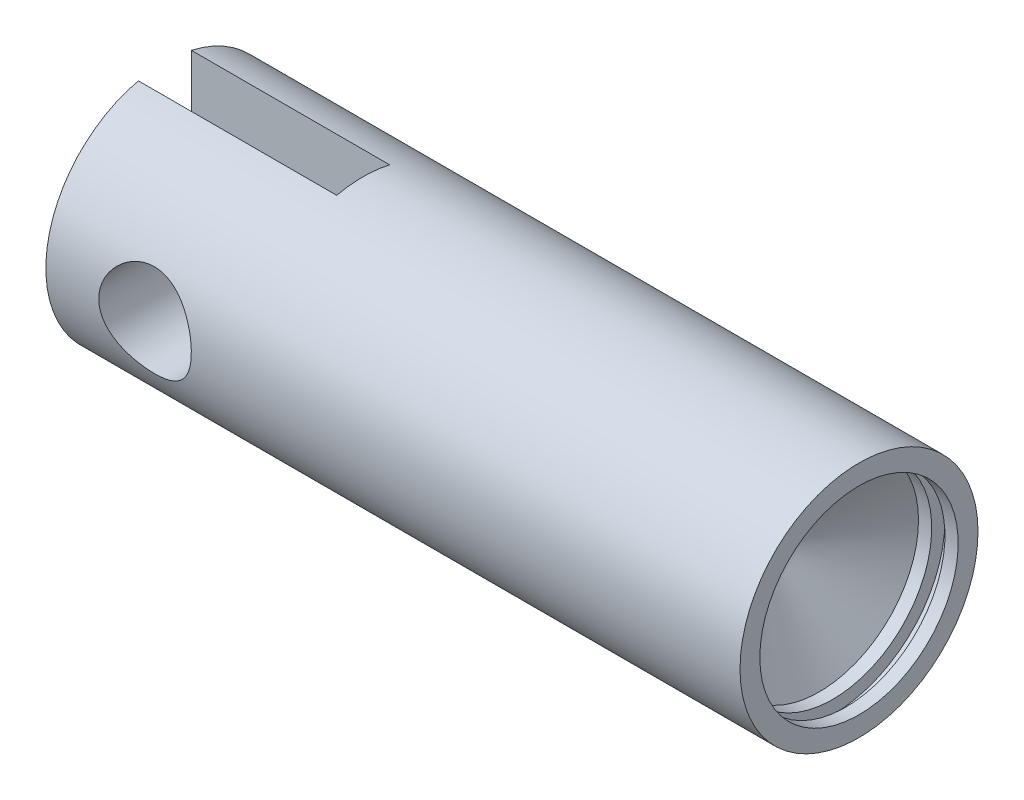
from build123d import *

# Parameters (mm, degrees)
ESQUISSE1_W                      = 105
ESQUISSE1_H                      = 18
ENL_V_MAT_EXTRU_1_DEPTH          = 30
EXTRUSION1_START                 = 30
EXTRUSION1_DEPTH                 = 30
ESQUISSE5_W                      = 7
ESQUISSE5_H                      = 14
DIAM_TRE_DU_PER_AGE_M14_0_14_2_D = 14


with BuildPart() as part:
    # Esquisse1 → Révolution1 (revolve)
    with BuildSketch(Plane.XY, mode=Mode.PRIVATE) as r_volution1_sk:
        with Locations((52.5, 9)):
            Rectangle(ESQUISSE1_W, ESQUISSE1_H)
    revolve(r_volution1_sk.sketch.rotate(Axis((0, 0, 0), (1, 0, 0)), 270), axis=Axis((0, 0, 0), (1, 0, 0)))

    # Esquisse2 → Enlèv. mat.-Extru.1 (cut)
    with BuildSketch(Plane.ZY):
        with BuildLine():
            Line((-4, 17.549928775), (-4, -17.549928775))
            ThreePointArc((-4, -17.549928775), (18, 0), (-4, 17.549928775))
        make_face()
    extrude(amount=-ENL_V_MAT_EXTRU_1_DEPTH, mode=Mode.SUBTRACT)

    # Esquisse3 → Extrusion1 (add)
    with BuildSketch(Plane.ZY.offset(-30).offset(EXTRUSION1_START)):
        with BuildLine():
            Line((4, -17.549928775), (4, 17.549928775))
            ThreePointArc((4, 17.549928775), (18, 0), (4, -17.549928775))
        make_face()
    extrude(amount=-EXTRUSION1_DEPTH)

    # Esquisse4 → Enlèvement de matière-Révolution1 (revolve, cut)
    with BuildSketch(Plane(origin=(0, 0, 0), x_dir=(-1, 0, 0), z_dir=(0, 0, -1)), mode=Mode.PRIVATE) as enl_vement_de_mati_re_r_volution1_sk:
        Polygon((-105, 15), (-105, 0), (-90.339745962, 0), (-99, 15), (-101, 15), (-101, 17), (-103, 17), (-103, 15), align=None)
    revolve(enl_vement_de_mati_re_r_volution1_sk.sketch.rotate(Axis((105.000025, 0, 0), (-1, 0, 0)), 270), axis=Axis((105.000025, 0, 0), (-1, 0, 0)), mode=Mode.SUBTRACT)

    # Esquisse5 → Diamètre du perçage M14.0 (14)1 (revolve, cut)
    with BuildSketch(Plane(origin=(15, 0, 4), x_dir=(0, 1, 0), z_dir=(1, 0, 0))):
        with Locations((3.5, 7)):
            Rectangle(ESQUISSE5_W, ESQUISSE5_H)
    revolve(axis=Axis((15, 0, -2.35), (0, 0, 1)), mode=Mode.SUBTRACT)

    # Diamètre du perçage M14.0 (14)2 (through all)
    with Locations(Plane.XY.offset(-4)):
        with Locations((15, 0)):
            Hole(DIAM_TRE_DU_PER_AGE_M14_0_14_2_D / 2)


solid = part.part
